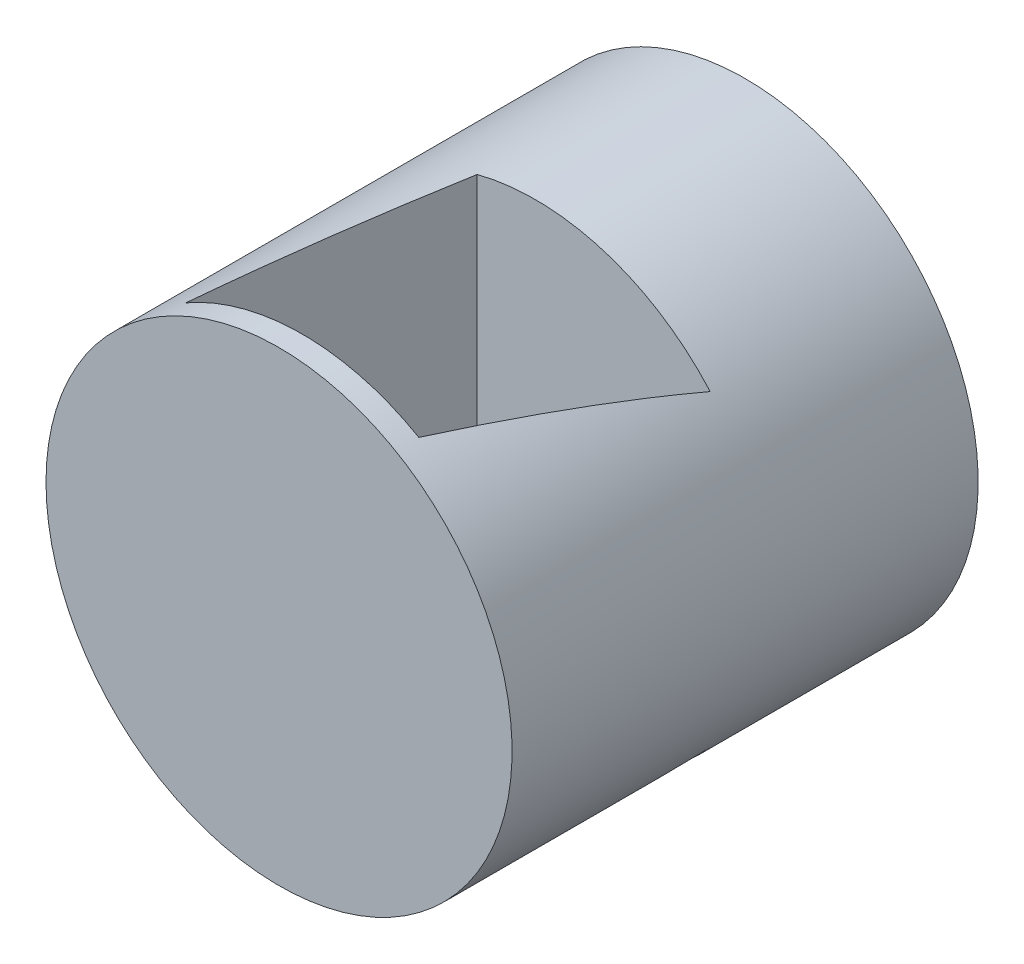
from build123d import *

# Parameters (mm, degrees)
SKETCH1_W                 = 10
SKETCH1_H                 = 20
CUT_EXTRUDE1_DEPTH        = 13
F_2_0MM_DOWEL_HOLE1_D     = 2
F_2_0MM_DOWEL_HOLE1_DEPTH = 10
F_2_0MM_DOWEL_HOLE1_TIP   = 0.600860619


with BuildPart() as part:
    # Sketch1 → Revolve1 (revolve)
    with BuildSketch(Plane(origin=(0, 0, 0), x_dir=(1, 0, 0), z_dir=(0, 1, 0)), mode=Mode.PRIVATE) as revolve1_sk:
        with Locations((5, 0)):
            Rectangle(SKETCH1_W, SKETCH1_H)
    revolve(revolve1_sk.sketch.rotate(Axis((0, 0, -10), (0, 0, 1)), 180), axis=Axis((0, 0, -10), (0, 0, 1)))

    # Sketch3 → Cut-Extrude1 (cut, symmetric)
    with BuildSketch(Plane(origin=(0, 0, 0), x_dir=(1, 0, 0), z_dir=(0, 1, 0))):
        Polygon((5, -9), (-5, -9), (-2.5, 1), (7.5, 1), align=None)
    extrude(amount=CUT_EXTRUDE1_DEPTH, both=True, mode=Mode.SUBTRACT)

    # Ø2.0mm Dowel Hole1
    with Locations(Plane(origin=(0, 0, -10), x_dir=(-1, 0, 0), z_dir=(0, 0, -1))):
        with Locations((0, 0)):
            Hole(F_2_0MM_DOWEL_HOLE1_D / 2, depth=F_2_0MM_DOWEL_HOLE1_DEPTH)
            with Locations((0, 0, -(F_2_0MM_DOWEL_HOLE1_DEPTH + F_2_0MM_DOWEL_HOLE1_TIP / 2))):  # 118° drill point
                Cone(0, F_2_0MM_DOWEL_HOLE1_D / 2, F_2_0MM_DOWEL_HOLE1_TIP, mode=Mode.SUBTRACT)


solid = part.part
